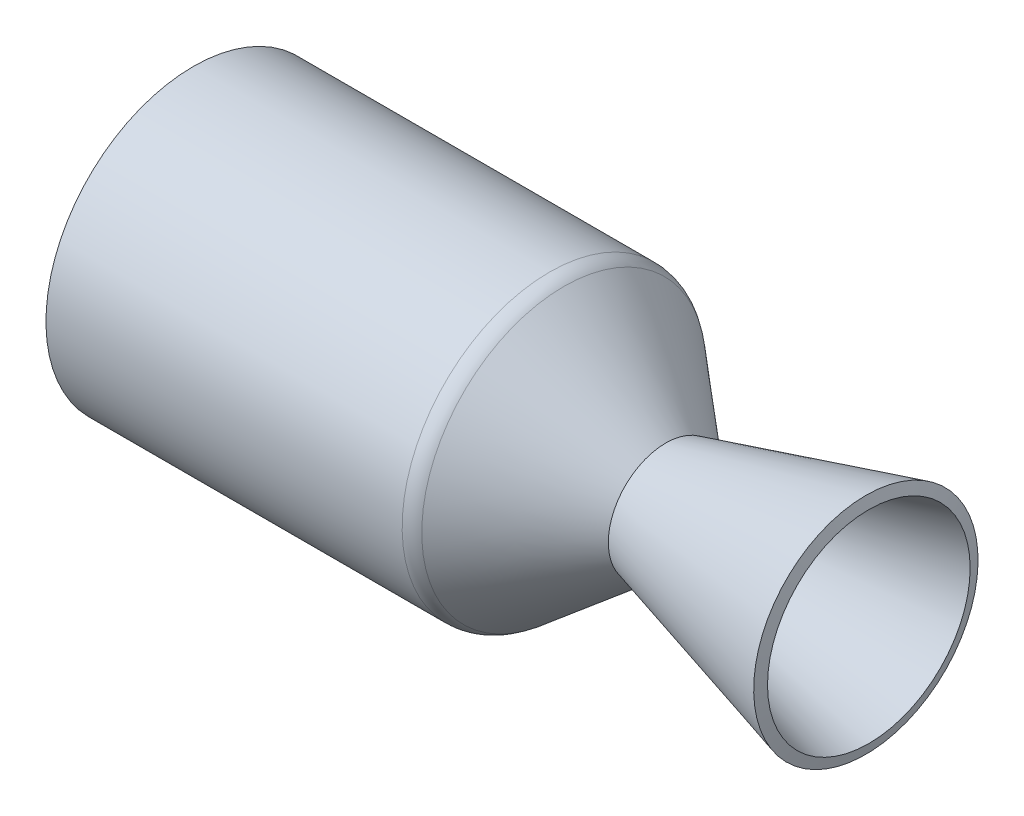
from build123d import *


with BuildPart() as part:
    # Sketch4 → Revolve3 (revolve)
    with BuildSketch(Plane.XY):
        with BuildLine():
            Line((-103.075250338, 65.451422493), (55.11646874, 65.451422493))
            ThreePointArc((55.11646874, 65.451422493), (58.517447493, 64.855322935), (61.51296186, 63.138091197))
            Line((61.51296186, 63.138091197), (106.730008788, 25.510538776))
            Line((106.730008788, 25.510538776), (195.605450204, 49.82280509))
            Line((195.605450204, 49.82280509), (196.924749662, 45))
            Line((196.924749662, 45), (108.049308246, 20.687733685))
            ThreePointArc((108.049308246, 20.687733685), (105.670550773, 20.624072904), (103.531762227, 21.667204424))
            Line((103.531762227, 21.667204424), (58.3147153, 59.294756845))
            ThreePointArc((58.3147153, 59.294756845), (56.816958116, 60.153372714), (55.11646874, 60.451422493))
            Line((55.11646874, 60.451422493), (-103.075250338, 60.451422493))
            Line((-103.075250338, 60.451422493), (-103.075250338, 65.451422493))
        make_face()
    revolve(axis=Axis((196.924749662, 0, 0), (-1, 0, 0)))


solid = part.part
